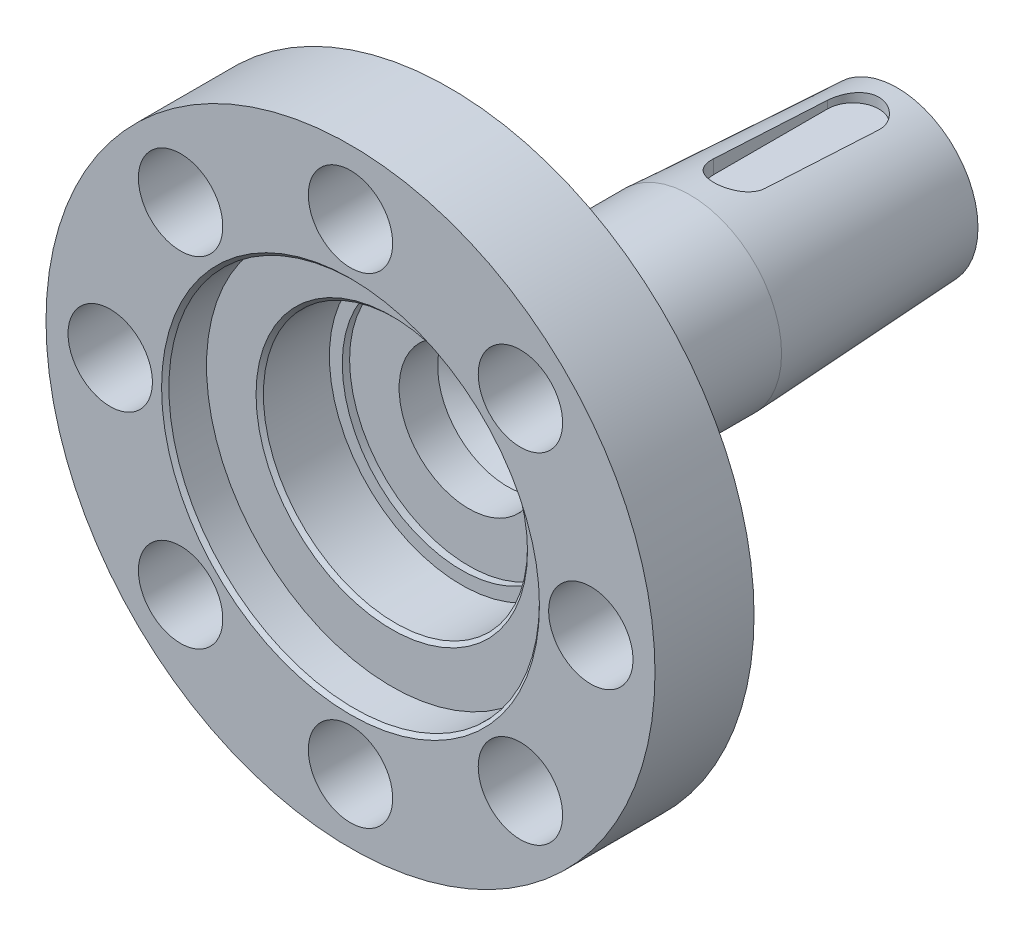
from build123d import *

# Parameters (mm, degrees)
HOLE_WIZARD_M20_1_D           = 17.5
HOLE_WIZARD_M20_1_DEPTH       = 35
HOLE_WIZARD_M20_1_CSINK_D     = 20.05
HOLE_WIZARD_M20_1_CSINK_ANGLE = 90
HOLE_WIZARD_M20_1_TIP         = 5.257530416
CUT_EXTRUDE_START             = 19.5
CUT_EXTRUDE_1_DEPTH           = 171.181311678
SKETCH_5_R                    = 50.5
CUT_EXTRUDE_2_DEPTH           = 11.25
SKETCH_6_R                    = 36
CUT_EXTRUDE_3_DEPTH           = 19
SKETCH_7_R                    = 32.5
CUT_EXTRUDE_4_DEPTH           = 32.25
CHAMFER_1_SIZE                = 1
HOLE_WIZARD_1_D               = 38
HOLE_WIZARD_1_DEPTH           = 42.75
HOLE_WIZARD_1_TIP             = 11.416351762
HOLE_WIZARD_2_D               = 23


with BuildPart() as part:
    # 草图1 → 旋转1 (revolve)
    with BuildSketch(Plane(origin=(0, 0, 0), x_dir=(0, 0, -1), z_dir=(1, 0, 0)), mode=Mode.PRIVATE) as revolve_1_sk:
        Polygon((0, 0), (0, 83), (27, 83), (27, 53.624355653), (48, 41.5), (48, 30), (50.5, 30), (50.5, 25), (92.5, 25), (149, 22.038960471), (149, 0), align=None)
    revolve(revolve_1_sk.sketch.rotate(Axis((0, 0, 0), (0, 0, -1)), 90), axis=Axis((0, 0, 0), (0, 0, -1)))

    # M20 螺纹孔1
    with Locations(Plane(origin=(0, 0, -149), x_dir=(-1, 0, 0), z_dir=(0, 0, -1))):
        with Locations((0, 0)):
            CounterSinkHole(HOLE_WIZARD_M20_1_D / 2, HOLE_WIZARD_M20_1_CSINK_D / 2, depth=HOLE_WIZARD_M20_1_DEPTH, counter_sink_angle=HOLE_WIZARD_M20_1_CSINK_ANGLE)
            with Locations((0, 0, -(HOLE_WIZARD_M20_1_DEPTH + HOLE_WIZARD_M20_1_TIP / 2))):  # 118° drill point
                Cone(0, HOLE_WIZARD_M20_1_D / 2, HOLE_WIZARD_M20_1_TIP, mode=Mode.SUBTRACT)

    # 草图4 → 切除-拉伸1 (cut, through all)
    with BuildSketch(Plane(origin=(0, 0, 0), x_dir=(1, 0, 0), z_dir=(0, 1, 0)).offset(CUT_EXTRUDE_START)):
        with BuildLine():
            Line((7, 137), (7, 106))
            ThreePointArc((7, 106), (0, 99), (-7, 106))
            Line((-7, 106), (-7, 137))
            ThreePointArc((-7, 137), (0, 144), (7, 137))
        make_face()
    extrude(amount=CUT_EXTRUDE_1_DEPTH, mode=Mode.SUBTRACT)

    # 草图5 → 切除-拉伸2 (cut)
    with BuildSketch(Plane.XY):
        Circle(SKETCH_5_R)
    extrude(amount=-CUT_EXTRUDE_2_DEPTH, mode=Mode.SUBTRACT)

    # 草图6 → 切除-拉伸3 (cut)
    with BuildSketch(Plane.XY.offset(-11.25)):
        Circle(SKETCH_6_R)
    extrude(amount=-CUT_EXTRUDE_3_DEPTH, mode=Mode.SUBTRACT)

    # 草图7 → 切除-拉伸4 (cut)
    with BuildSketch(Plane.XY):
        Circle(SKETCH_7_R)
    extrude(amount=-CUT_EXTRUDE_4_DEPTH, mode=Mode.SUBTRACT)

    # 倒角1
    chamfer_1_edges = [part.edges().sort_by_distance(p)[0] for p in [
        (-50.5, 0, 0),
        (-36, 0, -11.25),
    ]]
    chamfer(chamfer_1_edges, length=CHAMFER_1_SIZE)

    # 孔1
    with Locations(Plane.XY):
        with Locations((0, 0)):
            Hole(HOLE_WIZARD_1_D / 2, depth=HOLE_WIZARD_1_DEPTH)
            with Locations((0, 0, -(HOLE_WIZARD_1_DEPTH + HOLE_WIZARD_1_TIP / 2))):  # 118° drill point
                Cone(0, HOLE_WIZARD_1_D / 2, HOLE_WIZARD_1_TIP, mode=Mode.SUBTRACT)

    # 孔2 (through all)
    with Locations(Plane(origin=(0, 0, -27), x_dir=(-1, 0, 0), z_dir=(0, 0, -1))):
        with Locations((-46.315494168, 46.315494168), (0, 65.5), (46.315494168, 46.315494168), (65.5, 0), (46.315494168, -46.315494168), (0, -65.5), (-46.315494168, -46.315494168), (-65.5, 0)):
            Hole(HOLE_WIZARD_2_D / 2)


solid = part.part
